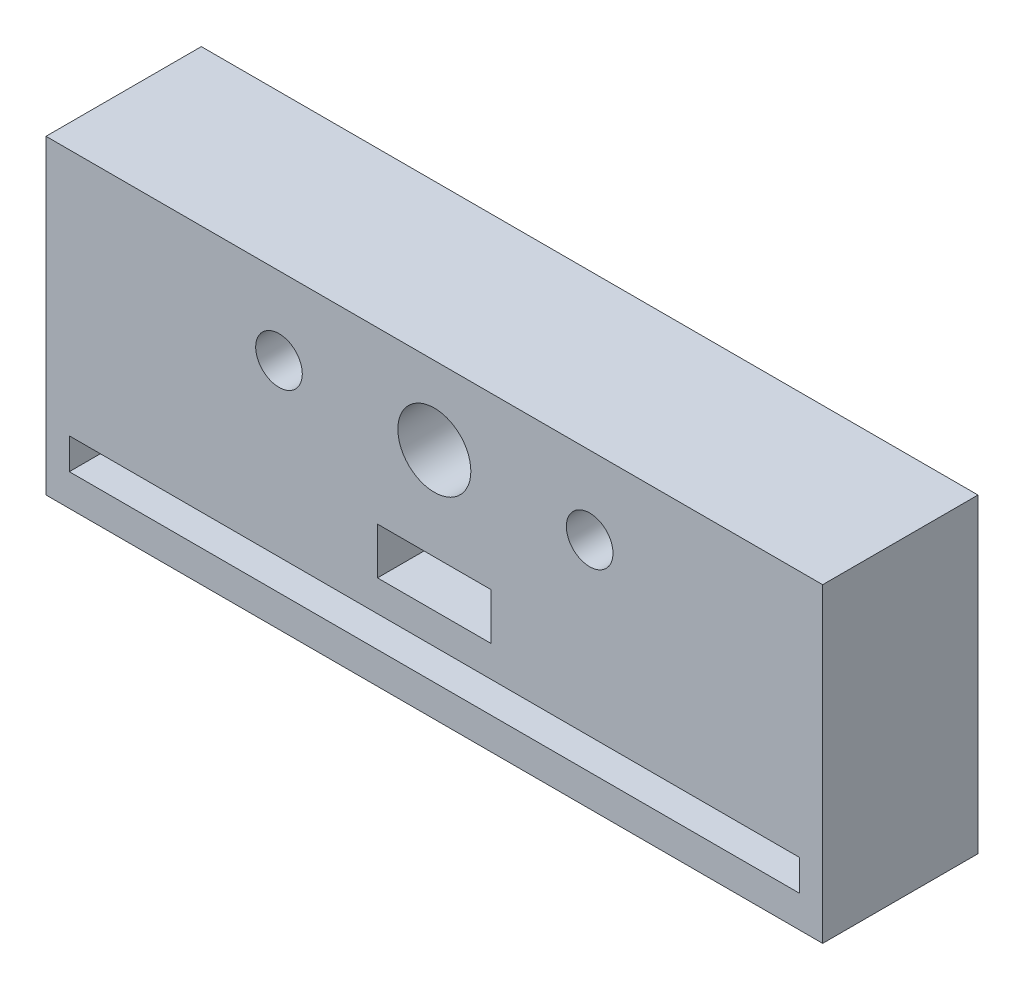
from build123d import *

# Parameters (mm, degrees)
SKETCH1_W           = 50
SKETCH1_H           = 20
SKETCH1_R           = 1.5
SKETCH1_R_2         = 2.35
SKETCH1_W_2         = 7.32
SKETCH1_H_2         = 3
SKETCH1_W_3         = 47
SKETCH1_H_3         = 2
BOSS_EXTRUDE1_DEPTH = 10


with BuildPart() as part:
    # Sketch1 → Boss-Extrude1 (new body)
    with BuildSketch(Plane.XY):
        with Locations((0, 2.450714286)):
            Rectangle(SKETCH1_W, SKETCH1_H)
        with Locations((-10, 7.450714286)):
            Circle(SKETCH1_R, mode=Mode.SUBTRACT)
        with Locations((10, 7.450714286)):
            Circle(SKETCH1_R, mode=Mode.SUBTRACT)
        with Locations((0, 7.450714286)):
            Circle(SKETCH1_R_2, mode=Mode.SUBTRACT)
        Rectangle(SKETCH1_W_2, SKETCH1_H_2, mode=Mode.SUBTRACT)
        with Locations((0, -4.5)):
            Rectangle(SKETCH1_W_3, SKETCH1_H_3, mode=Mode.SUBTRACT)
    extrude(amount=BOSS_EXTRUDE1_DEPTH)


solid = part.part
